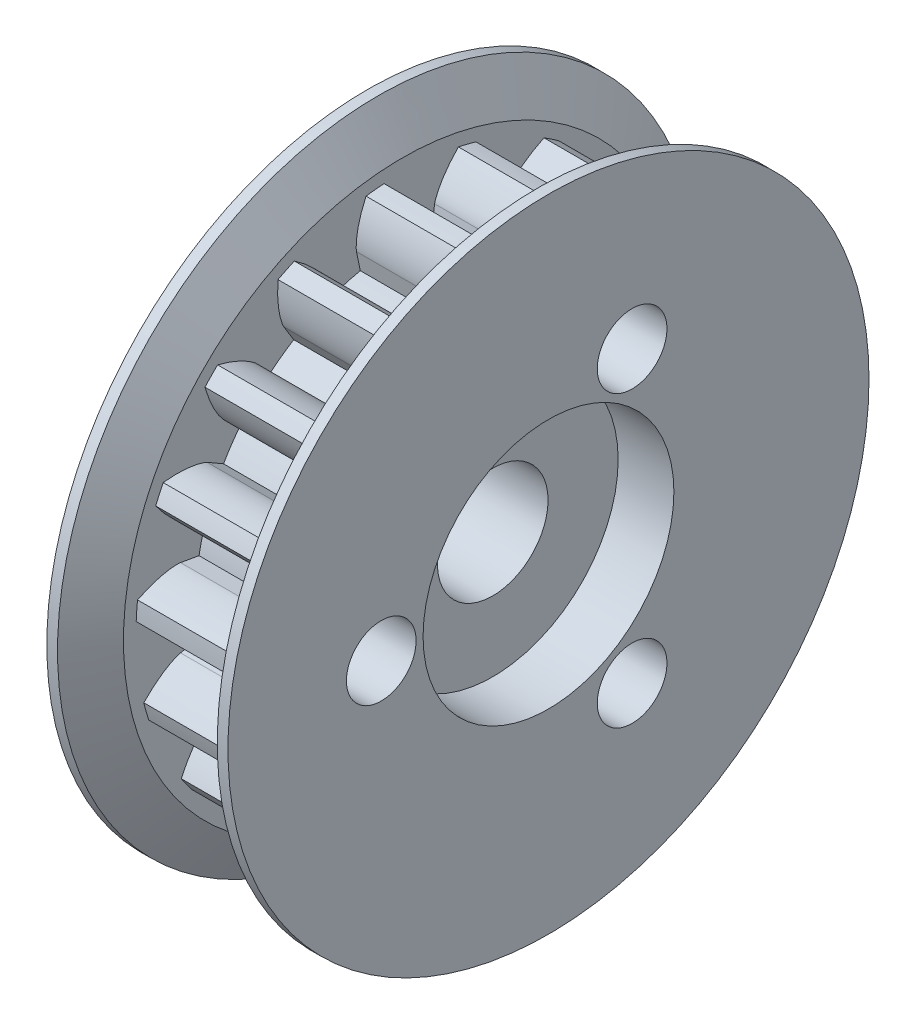
from build123d import *

# Parameters (mm, degrees)
SKETCH1_R                 = 9.549296586
BOSS_EXTRUDE1_DEPTH       = 4
CUT_EXTRUDE1_DEPTH        = 15.084677155
CIRPATTERN6_COUNT         = 18
CIRPATTERN6_COPY_1_DEPTH  = 15.084677155
CIRPATTERN6_COPY_2_DEPTH  = 15.084677155
CIRPATTERN6_COPY_3_DEPTH  = 15.084677155
CIRPATTERN6_COPY_4_DEPTH  = 15.084677155
CIRPATTERN6_COPY_5_DEPTH  = 15.084677155
CIRPATTERN6_COPY_6_DEPTH  = 15.084677155
CIRPATTERN6_COPY_7_DEPTH  = 15.084677155
CIRPATTERN6_COPY_8_DEPTH  = 15.084677155
CIRPATTERN6_COPY_9_DEPTH  = 15.084677155
CIRPATTERN6_COPY_10_DEPTH = 15.084677155
CIRPATTERN6_COPY_11_DEPTH = 15.084677155
CIRPATTERN6_COPY_12_DEPTH = 15.084677155
CIRPATTERN6_COPY_13_DEPTH = 15.084677155
CIRPATTERN6_COPY_14_DEPTH = 15.084677155
CIRPATTERN6_COPY_15_DEPTH = 15.084677155
CIRPATTERN6_COPY_16_DEPTH = 15.084677155
CIRPATTERN6_COPY_17_DEPTH = 15.084677155
SKETCH6_R                 = 1.984375
CUT_EXTRUDE2_DEPTH        = 18.514279888
HOLE4_D                   = 2.5
HOLE4_CBORE_D             = 3.5
HOLE4_CBORE_DEPTH         = 1
SKETCH5_R                 = 4.5
CUT_EXTRUDE3_DEPTH        = 2


with BuildPart() as part:
    # Sketch1 → Boss-Extrude1 (new body)
    with BuildSketch(Plane.YZ):
        with Locations(Location((0, 0, 0), (0, 0, 270))):
            Circle(SKETCH1_R)
    extrude(amount=BOSS_EXTRUDE1_DEPTH)

    # Sketch3 → Cut-Extrude1 (cut, through all)
    with BuildSketch(Plane.YZ.offset(4)):
        with BuildLine():
            Line((8.571875563, -0.62136318), (8.054928213, -0.583890395))
            Line((8.054928213, -0.583890395), (7.381337291, -0.535062738))
            ThreePointArc((7.381337291, -0.535062738), (7.395861378, -0.267706573), (7.400704854, 0))
            Line((7.400704854, 0), (8.076063182, 0))
            add(Edge.make_bspline(
                [(8.076063182, 0), (8.082033841, 0.00012635), (8.09876703, 0.000871736), (8.130332052, 0.00382423), (8.181625521, 0.010826224), (8.246585108, 0.022945376), (8.32993152, 0.042257196), (8.427178635, 0.069664315), (8.532881284, 0.104618669), (8.646430098, 0.147804525), (8.758283349, 0.195402246), (8.868399918, 0.247029253), (8.976688187, 0.302165598), (9.106061191, 0.373264706), (9.258599749, 0.464478117), (9.432758228, 0.579565538), (9.625120919, 0.719945389), (9.815166147, 0.873205208), (9.997074527, 1.03228781), (10.174564543, 1.202154555), (10.341789235, 1.372967989), (10.508498401, 1.5592586), (10.658859456, 1.735776296), (10.819120577, 1.942858552), (10.946095868, 2.112747676), (11.070131984, 2.295661885), (11.12943513, 2.385763569), (11.159288398, 2.432257279)],
                knots=[0, 0, 0, 0, 0, 0.005376748, 0.015083688, 0.02853182, 0.046610139, 0.064854849, 0.092110525, 0.119476175, 0.146842495, 0.174208853, 0.201574955, 0.228941013, 0.256307345, 0.307035032, 0.361767351, 0.41649966, 0.471231936, 0.525964281, 0.580696615, 0.635428982, 0.690161387, 0.744893688, 0.799626083, 0.854358408, 0.909090916, 0.909090916, 0.909090916, 0.909090916, 0.909090916], degree=4))
            Line((11.159288398, 2.432257279), (11.159288398, -0.80892109))
            Line((11.159288398, -0.80892109), (8.571875563, -0.62136318))
        make_face()
    cut_extrude1 = extrude(amount=-CUT_EXTRUDE1_DEPTH, mode=Mode.SUBTRACT)

    # Mirror1: Cut-Extrude1 across plane
    add(cut_extrude1.mirror(Plane(origin=(0, 8.571875563, -0.62136318), x_dir=(1, 0, 0), z_dir=(0, -0.07229888895007913, -0.9973830110126121))), mode=Mode.SUBTRACT)

    # CirPattern6: Cut-Extrude1 ×18 about axis
    cirpattern6_axis = Axis((4, 0, 0), (-1, 0, 0))
    for i in range(1, CIRPATTERN6_COUNT):
        add(cut_extrude1.rotate(cirpattern6_axis, i * 360 / CIRPATTERN6_COUNT), mode=Mode.SUBTRACT)

    # CirPattern6 copy 1 sketch → CirPattern6 copy 1 (cut, through all)
    with BuildSketch(Plane(origin=(4, 0, 0), x_dir=(0, 0.8805429024335611, -0.4739664513168418), z_dir=(1, 0, 0))):
        with BuildLine():
            Line((8.571875563, 0.62136318), (8.054928213, 0.583890395))
            Line((8.054928213, 0.583890395), (7.381337291, 0.535062738))
            ThreePointArc((7.381337291, 0.535062738), (7.395861378, 0.267706573), (7.400704854, 0))
            Line((7.400704854, 0), (8.076063182, 0))
            add(Edge.make_bspline(
                [(8.076063182, 0), (8.082033841, -0.00012635), (8.09876703, -0.000871736), (8.130332052, -0.00382423), (8.181625521, -0.010826224), (8.246585108, -0.022945376), (8.32993152, -0.042257196), (8.427178635, -0.069664315), (8.532881284, -0.104618669), (8.646430098, -0.147804525), (8.758283349, -0.195402246), (8.868399918, -0.247029253), (8.976688187, -0.302165598), (9.106061191, -0.373264706), (9.258599749, -0.464478117), (9.432758228, -0.579565538), (9.625120919, -0.719945389), (9.815166147, -0.873205208), (9.997074527, -1.03228781), (10.174564543, -1.202154555), (10.341789235, -1.372967989), (10.508498401, -1.5592586), (10.658859456, -1.735776296), (10.819120577, -1.942858552), (10.946095868, -2.112747676), (11.070131984, -2.295661885), (11.12943513, -2.385763569), (11.159288398, -2.432257279)],
                knots=[0, 0, 0, 0, 0, 0.005376748, 0.015083688, 0.02853182, 0.046610139, 0.064854849, 0.092110525, 0.119476175, 0.146842495, 0.174208853, 0.201574955, 0.228941013, 0.256307345, 0.307035032, 0.361767351, 0.41649966, 0.471231936, 0.525964281, 0.580696615, 0.635428982, 0.690161387, 0.744893688, 0.799626083, 0.854358408, 0.909090916, 0.909090916, 0.909090916, 0.909090916, 0.909090916], degree=4))
            Line((11.159288398, -2.432257279), (11.159288398, 0.80892109))
            Line((11.159288398, 0.80892109), (8.571875563, 0.62136318))
        make_face()
    extrude(amount=-CIRPATTERN6_COPY_1_DEPTH, mode=Mode.SUBTRACT)

    # CirPattern6 copy 2 sketch → CirPattern6 copy 2 (cut, through all)
    with BuildSketch(Plane(origin=(4, 0, 0), x_dir=(0, 0.6653335940912787, -0.7465461864972466), z_dir=(1, 0, 0))):
        with BuildLine():
            Line((8.571875563, 0.62136318), (8.054928213, 0.583890395))
            Line((8.054928213, 0.583890395), (7.381337291, 0.535062738))
            ThreePointArc((7.381337291, 0.535062738), (7.395861378, 0.267706573), (7.400704854, 0))
            Line((7.400704854, 0), (8.076063182, 0))
            add(Edge.make_bspline(
                [(8.076063182, 0), (8.082033841, -0.00012635), (8.09876703, -0.000871736), (8.130332052, -0.00382423), (8.181625521, -0.010826224), (8.246585108, -0.022945376), (8.32993152, -0.042257196), (8.427178635, -0.069664315), (8.532881284, -0.104618669), (8.646430098, -0.147804525), (8.758283349, -0.195402246), (8.868399918, -0.247029253), (8.976688187, -0.302165598), (9.106061191, -0.373264706), (9.258599749, -0.464478117), (9.432758228, -0.579565538), (9.625120919, -0.719945389), (9.815166147, -0.873205208), (9.997074527, -1.03228781), (10.174564543, -1.202154555), (10.341789235, -1.372967989), (10.508498401, -1.5592586), (10.658859456, -1.735776296), (10.819120577, -1.942858552), (10.946095868, -2.112747676), (11.070131984, -2.295661885), (11.12943513, -2.385763569), (11.159288398, -2.432257279)],
                knots=[0, 0, 0, 0, 0, 0.005376748, 0.015083688, 0.02853182, 0.046610139, 0.064854849, 0.092110525, 0.119476175, 0.146842495, 0.174208853, 0.201574955, 0.228941013, 0.256307345, 0.307035032, 0.361767351, 0.41649966, 0.471231936, 0.525964281, 0.580696615, 0.635428982, 0.690161387, 0.744893688, 0.799626083, 0.854358408, 0.909090916, 0.909090916, 0.909090916, 0.909090916, 0.909090916], degree=4))
            Line((11.159288398, -2.432257279), (11.159288398, 0.80892109))
            Line((11.159288398, 0.80892109), (8.571875563, 0.62136318))
        make_face()
    extrude(amount=-CIRPATTERN6_COPY_2_DEPTH, mode=Mode.SUBTRACT)

    # CirPattern6 copy 3 sketch → CirPattern6 copy 3 (cut, through all)
    with BuildSketch(Plane(origin=(4, 0, 0), x_dir=(0, 0.3698752350235218, -0.9290814337378046), z_dir=(1, 0, 0))):
        with BuildLine():
            Line((8.571875563, 0.62136318), (8.054928213, 0.583890395))
            Line((8.054928213, 0.583890395), (7.381337291, 0.535062738))
            ThreePointArc((7.381337291, 0.535062738), (7.395861378, 0.267706573), (7.400704854, 0))
            Line((7.400704854, 0), (8.076063182, 0))
            add(Edge.make_bspline(
                [(8.076063182, 0), (8.082033841, -0.00012635), (8.09876703, -0.000871736), (8.130332052, -0.00382423), (8.181625521, -0.010826224), (8.246585108, -0.022945376), (8.32993152, -0.042257196), (8.427178635, -0.069664315), (8.532881284, -0.104618669), (8.646430098, -0.147804525), (8.758283349, -0.195402246), (8.868399918, -0.247029253), (8.976688187, -0.302165598), (9.106061191, -0.373264706), (9.258599749, -0.464478117), (9.432758228, -0.579565538), (9.625120919, -0.719945389), (9.815166147, -0.873205208), (9.997074527, -1.03228781), (10.174564543, -1.202154555), (10.341789235, -1.372967989), (10.508498401, -1.5592586), (10.658859456, -1.735776296), (10.819120577, -1.942858552), (10.946095868, -2.112747676), (11.070131984, -2.295661885), (11.12943513, -2.385763569), (11.159288398, -2.432257279)],
                knots=[0, 0, 0, 0, 0, 0.005376748, 0.015083688, 0.02853182, 0.046610139, 0.064854849, 0.092110525, 0.119476175, 0.146842495, 0.174208853, 0.201574955, 0.228941013, 0.256307345, 0.307035032, 0.361767351, 0.41649966, 0.471231936, 0.525964281, 0.580696615, 0.635428982, 0.690161387, 0.744893688, 0.799626083, 0.854358408, 0.909090916, 0.909090916, 0.909090916, 0.909090916, 0.909090916], degree=4))
            Line((11.159288398, -2.432257279), (11.159288398, 0.80892109))
            Line((11.159288398, 0.80892109), (8.571875563, 0.62136318))
        make_face()
    extrude(amount=-CIRPATTERN6_COPY_3_DEPTH, mode=Mode.SUBTRACT)

    # CirPattern6 copy 4 sketch → CirPattern6 copy 4 (cut, through all)
    with BuildSketch(Plane(origin=(4, 0, 0), x_dir=(0, 0.029804463834835232, -0.9995557482879672), z_dir=(1, 0, 0))):
        with BuildLine():
            Line((8.571875563, 0.62136318), (8.054928213, 0.583890395))
            Line((8.054928213, 0.583890395), (7.381337291, 0.535062738))
            ThreePointArc((7.381337291, 0.535062738), (7.395861378, 0.267706573), (7.400704854, 0))
            Line((7.400704854, 0), (8.076063182, 0))
            add(Edge.make_bspline(
                [(8.076063182, 0), (8.082033841, -0.00012635), (8.09876703, -0.000871736), (8.130332052, -0.00382423), (8.181625521, -0.010826224), (8.246585108, -0.022945376), (8.32993152, -0.042257196), (8.427178635, -0.069664315), (8.532881284, -0.104618669), (8.646430098, -0.147804525), (8.758283349, -0.195402246), (8.868399918, -0.247029253), (8.976688187, -0.302165598), (9.106061191, -0.373264706), (9.258599749, -0.464478117), (9.432758228, -0.579565538), (9.625120919, -0.719945389), (9.815166147, -0.873205208), (9.997074527, -1.03228781), (10.174564543, -1.202154555), (10.341789235, -1.372967989), (10.508498401, -1.5592586), (10.658859456, -1.735776296), (10.819120577, -1.942858552), (10.946095868, -2.112747676), (11.070131984, -2.295661885), (11.12943513, -2.385763569), (11.159288398, -2.432257279)],
                knots=[0, 0, 0, 0, 0, 0.005376748, 0.015083688, 0.02853182, 0.046610139, 0.064854849, 0.092110525, 0.119476175, 0.146842495, 0.174208853, 0.201574955, 0.228941013, 0.256307345, 0.307035032, 0.361767351, 0.41649966, 0.471231936, 0.525964281, 0.580696615, 0.635428982, 0.690161387, 0.744893688, 0.799626083, 0.854358408, 0.909090916, 0.909090916, 0.909090916, 0.909090916, 0.909090916], degree=4))
            Line((11.159288398, -2.432257279), (11.159288398, 0.80892109))
            Line((11.159288398, 0.80892109), (8.571875563, 0.62136318))
        make_face()
    extrude(amount=-CIRPATTERN6_COPY_4_DEPTH, mode=Mode.SUBTRACT)

    # CirPattern6 copy 5 sketch → CirPattern6 copy 5 (cut, through all)
    with BuildSketch(Plane(origin=(4, 0, 0), x_dir=(0, -0.3138611655593715, -0.9494688877228746), z_dir=(1, 0, 0))):
        with BuildLine():
            Line((8.571875563, 0.62136318), (8.054928213, 0.583890395))
            Line((8.054928213, 0.583890395), (7.381337291, 0.535062738))
            ThreePointArc((7.381337291, 0.535062738), (7.395861378, 0.267706573), (7.400704854, 0))
            Line((7.400704854, 0), (8.076063182, 0))
            add(Edge.make_bspline(
                [(8.076063182, 0), (8.082033841, -0.00012635), (8.09876703, -0.000871736), (8.130332052, -0.00382423), (8.181625521, -0.010826224), (8.246585108, -0.022945376), (8.32993152, -0.042257196), (8.427178635, -0.069664315), (8.532881284, -0.104618669), (8.646430098, -0.147804525), (8.758283349, -0.195402246), (8.868399918, -0.247029253), (8.976688187, -0.302165598), (9.106061191, -0.373264706), (9.258599749, -0.464478117), (9.432758228, -0.579565538), (9.625120919, -0.719945389), (9.815166147, -0.873205208), (9.997074527, -1.03228781), (10.174564543, -1.202154555), (10.341789235, -1.372967989), (10.508498401, -1.5592586), (10.658859456, -1.735776296), (10.819120577, -1.942858552), (10.946095868, -2.112747676), (11.070131984, -2.295661885), (11.12943513, -2.385763569), (11.159288398, -2.432257279)],
                knots=[0, 0, 0, 0, 0, 0.005376748, 0.015083688, 0.02853182, 0.046610139, 0.064854849, 0.092110525, 0.119476175, 0.146842495, 0.174208853, 0.201574955, 0.228941013, 0.256307345, 0.307035032, 0.361767351, 0.41649966, 0.471231936, 0.525964281, 0.580696615, 0.635428982, 0.690161387, 0.744893688, 0.799626083, 0.854358408, 0.909090916, 0.909090916, 0.909090916, 0.909090916, 0.909090916], degree=4))
            Line((11.159288398, -2.432257279), (11.159288398, 0.80892109))
            Line((11.159288398, 0.80892109), (8.571875563, 0.62136318))
        make_face()
    extrude(amount=-CIRPATTERN6_COPY_5_DEPTH, mode=Mode.SUBTRACT)

    # CirPattern6 copy 6 sketch → CirPattern6 copy 6 (cut, through all)
    with BuildSketch(Plane(origin=(4, 0, 0), x_dir=(0, -0.6196705062896464, -0.784862066630012), z_dir=(1, 0, 0))):
        with BuildLine():
            Line((8.571875563, 0.62136318), (8.054928213, 0.583890395))
            Line((8.054928213, 0.583890395), (7.381337291, 0.535062738))
            ThreePointArc((7.381337291, 0.535062738), (7.395861378, 0.267706573), (7.400704854, 0))
            Line((7.400704854, 0), (8.076063182, 0))
            add(Edge.make_bspline(
                [(8.076063182, 0), (8.082033841, -0.00012635), (8.09876703, -0.000871736), (8.130332052, -0.00382423), (8.181625521, -0.010826224), (8.246585108, -0.022945376), (8.32993152, -0.042257196), (8.427178635, -0.069664315), (8.532881284, -0.104618669), (8.646430098, -0.147804525), (8.758283349, -0.195402246), (8.868399918, -0.247029253), (8.976688187, -0.302165598), (9.106061191, -0.373264706), (9.258599749, -0.464478117), (9.432758228, -0.579565538), (9.625120919, -0.719945389), (9.815166147, -0.873205208), (9.997074527, -1.03228781), (10.174564543, -1.202154555), (10.341789235, -1.372967989), (10.508498401, -1.5592586), (10.658859456, -1.735776296), (10.819120577, -1.942858552), (10.946095868, -2.112747676), (11.070131984, -2.295661885), (11.12943513, -2.385763569), (11.159288398, -2.432257279)],
                knots=[0, 0, 0, 0, 0, 0.005376748, 0.015083688, 0.02853182, 0.046610139, 0.064854849, 0.092110525, 0.119476175, 0.146842495, 0.174208853, 0.201574955, 0.228941013, 0.256307345, 0.307035032, 0.361767351, 0.41649966, 0.471231936, 0.525964281, 0.580696615, 0.635428982, 0.690161387, 0.744893688, 0.799626083, 0.854358408, 0.909090916, 0.909090916, 0.909090916, 0.909090916, 0.909090916], degree=4))
            Line((11.159288398, -2.432257279), (11.159288398, 0.80892109))
            Line((11.159288398, 0.80892109), (8.571875563, 0.62136318))
        make_face()
    extrude(amount=-CIRPATTERN6_COPY_6_DEPTH, mode=Mode.SUBTRACT)

    # CirPattern6 copy 7 sketch → CirPattern6 copy 7 (cut, through all)
    with BuildSketch(Plane(origin=(4, 0, 0), x_dir=(0, -0.8507384385987258, -0.5255892969711257), z_dir=(1, 0, 0))):
        with BuildLine():
            Line((8.571875563, 0.62136318), (8.054928213, 0.583890395))
            Line((8.054928213, 0.583890395), (7.381337291, 0.535062738))
            ThreePointArc((7.381337291, 0.535062738), (7.395861378, 0.267706573), (7.400704854, 0))
            Line((7.400704854, 0), (8.076063182, 0))
            add(Edge.make_bspline(
                [(8.076063182, 0), (8.082033841, -0.00012635), (8.09876703, -0.000871736), (8.130332052, -0.00382423), (8.181625521, -0.010826224), (8.246585108, -0.022945376), (8.32993152, -0.042257196), (8.427178635, -0.069664315), (8.532881284, -0.104618669), (8.646430098, -0.147804525), (8.758283349, -0.195402246), (8.868399918, -0.247029253), (8.976688187, -0.302165598), (9.106061191, -0.373264706), (9.258599749, -0.464478117), (9.432758228, -0.579565538), (9.625120919, -0.719945389), (9.815166147, -0.873205208), (9.997074527, -1.03228781), (10.174564543, -1.202154555), (10.341789235, -1.372967989), (10.508498401, -1.5592586), (10.658859456, -1.735776296), (10.819120577, -1.942858552), (10.946095868, -2.112747676), (11.070131984, -2.295661885), (11.12943513, -2.385763569), (11.159288398, -2.432257279)],
                knots=[0, 0, 0, 0, 0, 0.005376748, 0.015083688, 0.02853182, 0.046610139, 0.064854849, 0.092110525, 0.119476175, 0.146842495, 0.174208853, 0.201574955, 0.228941013, 0.256307345, 0.307035032, 0.361767351, 0.41649966, 0.471231936, 0.525964281, 0.580696615, 0.635428982, 0.690161387, 0.744893688, 0.799626083, 0.854358408, 0.909090916, 0.909090916, 0.909090916, 0.909090916, 0.909090916], degree=4))
            Line((11.159288398, -2.432257279), (11.159288398, 0.80892109))
            Line((11.159288398, 0.80892109), (8.571875563, 0.62136318))
        make_face()
    extrude(amount=-CIRPATTERN6_COPY_7_DEPTH, mode=Mode.SUBTRACT)

    # CirPattern6 copy 8 sketch → CirPattern6 copy 8 (cut, through all)
    with BuildSketch(Plane(origin=(4, 0, 0), x_dir=(0, -0.9791947596506502, -0.20292270122562825), z_dir=(1, 0, 0))):
        with BuildLine():
            Line((8.571875563, 0.62136318), (8.054928213, 0.583890395))
            Line((8.054928213, 0.583890395), (7.381337291, 0.535062738))
            ThreePointArc((7.381337291, 0.535062738), (7.395861378, 0.267706573), (7.400704854, 0))
            Line((7.400704854, 0), (8.076063182, 0))
            add(Edge.make_bspline(
                [(8.076063182, 0), (8.082033841, -0.00012635), (8.09876703, -0.000871736), (8.130332052, -0.00382423), (8.181625521, -0.010826224), (8.246585108, -0.022945376), (8.32993152, -0.042257196), (8.427178635, -0.069664315), (8.532881284, -0.104618669), (8.646430098, -0.147804525), (8.758283349, -0.195402246), (8.868399918, -0.247029253), (8.976688187, -0.302165598), (9.106061191, -0.373264706), (9.258599749, -0.464478117), (9.432758228, -0.579565538), (9.625120919, -0.719945389), (9.815166147, -0.873205208), (9.997074527, -1.03228781), (10.174564543, -1.202154555), (10.341789235, -1.372967989), (10.508498401, -1.5592586), (10.658859456, -1.735776296), (10.819120577, -1.942858552), (10.946095868, -2.112747676), (11.070131984, -2.295661885), (11.12943513, -2.385763569), (11.159288398, -2.432257279)],
                knots=[0, 0, 0, 0, 0, 0.005376748, 0.015083688, 0.02853182, 0.046610139, 0.064854849, 0.092110525, 0.119476175, 0.146842495, 0.174208853, 0.201574955, 0.228941013, 0.256307345, 0.307035032, 0.361767351, 0.41649966, 0.471231936, 0.525964281, 0.580696615, 0.635428982, 0.690161387, 0.744893688, 0.799626083, 0.854358408, 0.909090916, 0.909090916, 0.909090916, 0.909090916, 0.909090916], degree=4))
            Line((11.159288398, -2.432257279), (11.159288398, 0.80892109))
            Line((11.159288398, 0.80892109), (8.571875563, 0.62136318))
        make_face()
    extrude(amount=-CIRPATTERN6_COPY_8_DEPTH, mode=Mode.SUBTRACT)

    # CirPattern6 copy 9 sketch → CirPattern6 copy 9 (cut, through all)
    with BuildSketch(Plane(origin=(4, 0, 0), x_dir=(0, -0.9895457413131683, 0.14421936710779268), z_dir=(1, 0, 0))):
        with BuildLine():
            Line((8.571875563, 0.62136318), (8.054928213, 0.583890395))
            Line((8.054928213, 0.583890395), (7.381337291, 0.535062738))
            ThreePointArc((7.381337291, 0.535062738), (7.395861378, 0.267706573), (7.400704854, 0))
            Line((7.400704854, 0), (8.076063182, 0))
            add(Edge.make_bspline(
                [(8.076063182, 0), (8.082033841, -0.00012635), (8.09876703, -0.000871736), (8.130332052, -0.00382423), (8.181625521, -0.010826224), (8.246585108, -0.022945376), (8.32993152, -0.042257196), (8.427178635, -0.069664315), (8.532881284, -0.104618669), (8.646430098, -0.147804525), (8.758283349, -0.195402246), (8.868399918, -0.247029253), (8.976688187, -0.302165598), (9.106061191, -0.373264706), (9.258599749, -0.464478117), (9.432758228, -0.579565538), (9.625120919, -0.719945389), (9.815166147, -0.873205208), (9.997074527, -1.03228781), (10.174564543, -1.202154555), (10.341789235, -1.372967989), (10.508498401, -1.5592586), (10.658859456, -1.735776296), (10.819120577, -1.942858552), (10.946095868, -2.112747676), (11.070131984, -2.295661885), (11.12943513, -2.385763569), (11.159288398, -2.432257279)],
                knots=[0, 0, 0, 0, 0, 0.005376748, 0.015083688, 0.02853182, 0.046610139, 0.064854849, 0.092110525, 0.119476175, 0.146842495, 0.174208853, 0.201574955, 0.228941013, 0.256307345, 0.307035032, 0.361767351, 0.41649966, 0.471231936, 0.525964281, 0.580696615, 0.635428982, 0.690161387, 0.744893688, 0.799626083, 0.854358408, 0.909090916, 0.909090916, 0.909090916, 0.909090916, 0.909090916], degree=4))
            Line((11.159288398, -2.432257279), (11.159288398, 0.80892109))
            Line((11.159288398, 0.80892109), (8.571875563, 0.62136318))
        make_face()
    extrude(amount=-CIRPATTERN6_COPY_9_DEPTH, mode=Mode.SUBTRACT)

    # CirPattern6 copy 10 sketch → CirPattern6 copy 10 (cut, through all)
    with BuildSketch(Plane(origin=(4, 0, 0), x_dir=(0, -0.8805429024335611, 0.4739664513168417), z_dir=(1, 0, 0))):
        with BuildLine():
            Line((8.571875563, 0.62136318), (8.054928213, 0.583890395))
            Line((8.054928213, 0.583890395), (7.381337291, 0.535062738))
            ThreePointArc((7.381337291, 0.535062738), (7.395861378, 0.267706573), (7.400704854, 0))
            Line((7.400704854, 0), (8.076063182, 0))
            add(Edge.make_bspline(
                [(8.076063182, 0), (8.082033841, -0.00012635), (8.09876703, -0.000871736), (8.130332052, -0.00382423), (8.181625521, -0.010826224), (8.246585108, -0.022945376), (8.32993152, -0.042257196), (8.427178635, -0.069664315), (8.532881284, -0.104618669), (8.646430098, -0.147804525), (8.758283349, -0.195402246), (8.868399918, -0.247029253), (8.976688187, -0.302165598), (9.106061191, -0.373264706), (9.258599749, -0.464478117), (9.432758228, -0.579565538), (9.625120919, -0.719945389), (9.815166147, -0.873205208), (9.997074527, -1.03228781), (10.174564543, -1.202154555), (10.341789235, -1.372967989), (10.508498401, -1.5592586), (10.658859456, -1.735776296), (10.819120577, -1.942858552), (10.946095868, -2.112747676), (11.070131984, -2.295661885), (11.12943513, -2.385763569), (11.159288398, -2.432257279)],
                knots=[0, 0, 0, 0, 0, 0.005376748, 0.015083688, 0.02853182, 0.046610139, 0.064854849, 0.092110525, 0.119476175, 0.146842495, 0.174208853, 0.201574955, 0.228941013, 0.256307345, 0.307035032, 0.361767351, 0.41649966, 0.471231936, 0.525964281, 0.580696615, 0.635428982, 0.690161387, 0.744893688, 0.799626083, 0.854358408, 0.909090916, 0.909090916, 0.909090916, 0.909090916, 0.909090916], degree=4))
            Line((11.159288398, -2.432257279), (11.159288398, 0.80892109))
            Line((11.159288398, 0.80892109), (8.571875563, 0.62136318))
        make_face()
    extrude(amount=-CIRPATTERN6_COPY_10_DEPTH, mode=Mode.SUBTRACT)

    # CirPattern6 copy 11 sketch → CirPattern6 copy 11 (cut, through all)
    with BuildSketch(Plane(origin=(4, 0, 0), x_dir=(0, -0.6653335940912787, 0.7465461864972466), z_dir=(1, 0, 0))):
        with BuildLine():
            Line((8.571875563, 0.62136318), (8.054928213, 0.583890395))
            Line((8.054928213, 0.583890395), (7.381337291, 0.535062738))
            ThreePointArc((7.381337291, 0.535062738), (7.395861378, 0.267706573), (7.400704854, 0))
            Line((7.400704854, 0), (8.076063182, 0))
            add(Edge.make_bspline(
                [(8.076063182, 0), (8.082033841, -0.00012635), (8.09876703, -0.000871736), (8.130332052, -0.00382423), (8.181625521, -0.010826224), (8.246585108, -0.022945376), (8.32993152, -0.042257196), (8.427178635, -0.069664315), (8.532881284, -0.104618669), (8.646430098, -0.147804525), (8.758283349, -0.195402246), (8.868399918, -0.247029253), (8.976688187, -0.302165598), (9.106061191, -0.373264706), (9.258599749, -0.464478117), (9.432758228, -0.579565538), (9.625120919, -0.719945389), (9.815166147, -0.873205208), (9.997074527, -1.03228781), (10.174564543, -1.202154555), (10.341789235, -1.372967989), (10.508498401, -1.5592586), (10.658859456, -1.735776296), (10.819120577, -1.942858552), (10.946095868, -2.112747676), (11.070131984, -2.295661885), (11.12943513, -2.385763569), (11.159288398, -2.432257279)],
                knots=[0, 0, 0, 0, 0, 0.005376748, 0.015083688, 0.02853182, 0.046610139, 0.064854849, 0.092110525, 0.119476175, 0.146842495, 0.174208853, 0.201574955, 0.228941013, 0.256307345, 0.307035032, 0.361767351, 0.41649966, 0.471231936, 0.525964281, 0.580696615, 0.635428982, 0.690161387, 0.744893688, 0.799626083, 0.854358408, 0.909090916, 0.909090916, 0.909090916, 0.909090916, 0.909090916], degree=4))
            Line((11.159288398, -2.432257279), (11.159288398, 0.80892109))
            Line((11.159288398, 0.80892109), (8.571875563, 0.62136318))
        make_face()
    extrude(amount=-CIRPATTERN6_COPY_11_DEPTH, mode=Mode.SUBTRACT)

    # CirPattern6 copy 12 sketch → CirPattern6 copy 12 (cut, through all)
    with BuildSketch(Plane(origin=(4, 0, 0), x_dir=(0, -0.3698752350235222, 0.9290814337378045), z_dir=(1, 0, 0))):
        with BuildLine():
            Line((8.571875563, 0.62136318), (8.054928213, 0.583890395))
            Line((8.054928213, 0.583890395), (7.381337291, 0.535062738))
            ThreePointArc((7.381337291, 0.535062738), (7.395861378, 0.267706573), (7.400704854, 0))
            Line((7.400704854, 0), (8.076063182, 0))
            add(Edge.make_bspline(
                [(8.076063182, 0), (8.082033841, -0.00012635), (8.09876703, -0.000871736), (8.130332052, -0.00382423), (8.181625521, -0.010826224), (8.246585108, -0.022945376), (8.32993152, -0.042257196), (8.427178635, -0.069664315), (8.532881284, -0.104618669), (8.646430098, -0.147804525), (8.758283349, -0.195402246), (8.868399918, -0.247029253), (8.976688187, -0.302165598), (9.106061191, -0.373264706), (9.258599749, -0.464478117), (9.432758228, -0.579565538), (9.625120919, -0.719945389), (9.815166147, -0.873205208), (9.997074527, -1.03228781), (10.174564543, -1.202154555), (10.341789235, -1.372967989), (10.508498401, -1.5592586), (10.658859456, -1.735776296), (10.819120577, -1.942858552), (10.946095868, -2.112747676), (11.070131984, -2.295661885), (11.12943513, -2.385763569), (11.159288398, -2.432257279)],
                knots=[0, 0, 0, 0, 0, 0.005376748, 0.015083688, 0.02853182, 0.046610139, 0.064854849, 0.092110525, 0.119476175, 0.146842495, 0.174208853, 0.201574955, 0.228941013, 0.256307345, 0.307035032, 0.361767351, 0.41649966, 0.471231936, 0.525964281, 0.580696615, 0.635428982, 0.690161387, 0.744893688, 0.799626083, 0.854358408, 0.909090916, 0.909090916, 0.909090916, 0.909090916, 0.909090916], degree=4))
            Line((11.159288398, -2.432257279), (11.159288398, 0.80892109))
            Line((11.159288398, 0.80892109), (8.571875563, 0.62136318))
        make_face()
    extrude(amount=-CIRPATTERN6_COPY_12_DEPTH, mode=Mode.SUBTRACT)

    # CirPattern6 copy 13 sketch → CirPattern6 copy 13 (cut, through all)
    with BuildSketch(Plane(origin=(4, 0, 0), x_dir=(0, -0.02980446383483515, 0.9995557482879672), z_dir=(1, 0, 0))):
        with BuildLine():
            Line((8.571875563, 0.62136318), (8.054928213, 0.583890395))
            Line((8.054928213, 0.583890395), (7.381337291, 0.535062738))
            ThreePointArc((7.381337291, 0.535062738), (7.395861378, 0.267706573), (7.400704854, 0))
            Line((7.400704854, 0), (8.076063182, 0))
            add(Edge.make_bspline(
                [(8.076063182, 0), (8.082033841, -0.00012635), (8.09876703, -0.000871736), (8.130332052, -0.00382423), (8.181625521, -0.010826224), (8.246585108, -0.022945376), (8.32993152, -0.042257196), (8.427178635, -0.069664315), (8.532881284, -0.104618669), (8.646430098, -0.147804525), (8.758283349, -0.195402246), (8.868399918, -0.247029253), (8.976688187, -0.302165598), (9.106061191, -0.373264706), (9.258599749, -0.464478117), (9.432758228, -0.579565538), (9.625120919, -0.719945389), (9.815166147, -0.873205208), (9.997074527, -1.03228781), (10.174564543, -1.202154555), (10.341789235, -1.372967989), (10.508498401, -1.5592586), (10.658859456, -1.735776296), (10.819120577, -1.942858552), (10.946095868, -2.112747676), (11.070131984, -2.295661885), (11.12943513, -2.385763569), (11.159288398, -2.432257279)],
                knots=[0, 0, 0, 0, 0, 0.005376748, 0.015083688, 0.02853182, 0.046610139, 0.064854849, 0.092110525, 0.119476175, 0.146842495, 0.174208853, 0.201574955, 0.228941013, 0.256307345, 0.307035032, 0.361767351, 0.41649966, 0.471231936, 0.525964281, 0.580696615, 0.635428982, 0.690161387, 0.744893688, 0.799626083, 0.854358408, 0.909090916, 0.909090916, 0.909090916, 0.909090916, 0.909090916], degree=4))
            Line((11.159288398, -2.432257279), (11.159288398, 0.80892109))
            Line((11.159288398, 0.80892109), (8.571875563, 0.62136318))
        make_face()
    extrude(amount=-CIRPATTERN6_COPY_13_DEPTH, mode=Mode.SUBTRACT)

    # CirPattern6 copy 14 sketch → CirPattern6 copy 14 (cut, through all)
    with BuildSketch(Plane(origin=(4, 0, 0), x_dir=(0, 0.31386116555937116, 0.9494688877228749), z_dir=(1, 0, 0))):
        with BuildLine():
            Line((8.571875563, 0.62136318), (8.054928213, 0.583890395))
            Line((8.054928213, 0.583890395), (7.381337291, 0.535062738))
            ThreePointArc((7.381337291, 0.535062738), (7.395861378, 0.267706573), (7.400704854, 0))
            Line((7.400704854, 0), (8.076063182, 0))
            add(Edge.make_bspline(
                [(8.076063182, 0), (8.082033841, -0.00012635), (8.09876703, -0.000871736), (8.130332052, -0.00382423), (8.181625521, -0.010826224), (8.246585108, -0.022945376), (8.32993152, -0.042257196), (8.427178635, -0.069664315), (8.532881284, -0.104618669), (8.646430098, -0.147804525), (8.758283349, -0.195402246), (8.868399918, -0.247029253), (8.976688187, -0.302165598), (9.106061191, -0.373264706), (9.258599749, -0.464478117), (9.432758228, -0.579565538), (9.625120919, -0.719945389), (9.815166147, -0.873205208), (9.997074527, -1.03228781), (10.174564543, -1.202154555), (10.341789235, -1.372967989), (10.508498401, -1.5592586), (10.658859456, -1.735776296), (10.819120577, -1.942858552), (10.946095868, -2.112747676), (11.070131984, -2.295661885), (11.12943513, -2.385763569), (11.159288398, -2.432257279)],
                knots=[0, 0, 0, 0, 0, 0.005376748, 0.015083688, 0.02853182, 0.046610139, 0.064854849, 0.092110525, 0.119476175, 0.146842495, 0.174208853, 0.201574955, 0.228941013, 0.256307345, 0.307035032, 0.361767351, 0.41649966, 0.471231936, 0.525964281, 0.580696615, 0.635428982, 0.690161387, 0.744893688, 0.799626083, 0.854358408, 0.909090916, 0.909090916, 0.909090916, 0.909090916, 0.909090916], degree=4))
            Line((11.159288398, -2.432257279), (11.159288398, 0.80892109))
            Line((11.159288398, 0.80892109), (8.571875563, 0.62136318))
        make_face()
    extrude(amount=-CIRPATTERN6_COPY_14_DEPTH, mode=Mode.SUBTRACT)

    # CirPattern6 copy 15 sketch → CirPattern6 copy 15 (cut, through all)
    with BuildSketch(Plane(origin=(4, 0, 0), x_dir=(0, 0.6196705062896467, 0.7848620666300119), z_dir=(1, 0, 0))):
        with BuildLine():
            Line((8.571875563, 0.62136318), (8.054928213, 0.583890395))
            Line((8.054928213, 0.583890395), (7.381337291, 0.535062738))
            ThreePointArc((7.381337291, 0.535062738), (7.395861378, 0.267706573), (7.400704854, 0))
            Line((7.400704854, 0), (8.076063182, 0))
            add(Edge.make_bspline(
                [(8.076063182, 0), (8.082033841, -0.00012635), (8.09876703, -0.000871736), (8.130332052, -0.00382423), (8.181625521, -0.010826224), (8.246585108, -0.022945376), (8.32993152, -0.042257196), (8.427178635, -0.069664315), (8.532881284, -0.104618669), (8.646430098, -0.147804525), (8.758283349, -0.195402246), (8.868399918, -0.247029253), (8.976688187, -0.302165598), (9.106061191, -0.373264706), (9.258599749, -0.464478117), (9.432758228, -0.579565538), (9.625120919, -0.719945389), (9.815166147, -0.873205208), (9.997074527, -1.03228781), (10.174564543, -1.202154555), (10.341789235, -1.372967989), (10.508498401, -1.5592586), (10.658859456, -1.735776296), (10.819120577, -1.942858552), (10.946095868, -2.112747676), (11.070131984, -2.295661885), (11.12943513, -2.385763569), (11.159288398, -2.432257279)],
                knots=[0, 0, 0, 0, 0, 0.005376748, 0.015083688, 0.02853182, 0.046610139, 0.064854849, 0.092110525, 0.119476175, 0.146842495, 0.174208853, 0.201574955, 0.228941013, 0.256307345, 0.307035032, 0.361767351, 0.41649966, 0.471231936, 0.525964281, 0.580696615, 0.635428982, 0.690161387, 0.744893688, 0.799626083, 0.854358408, 0.909090916, 0.909090916, 0.909090916, 0.909090916, 0.909090916], degree=4))
            Line((11.159288398, -2.432257279), (11.159288398, 0.80892109))
            Line((11.159288398, 0.80892109), (8.571875563, 0.62136318))
        make_face()
    extrude(amount=-CIRPATTERN6_COPY_15_DEPTH, mode=Mode.SUBTRACT)

    # CirPattern6 copy 16 sketch → CirPattern6 copy 16 (cut, through all)
    with BuildSketch(Plane(origin=(4, 0, 0), x_dir=(0, 0.8507384385987258, 0.5255892969711258), z_dir=(1, 0, 0))):
        with BuildLine():
            Line((8.571875563, 0.62136318), (8.054928213, 0.583890395))
            Line((8.054928213, 0.583890395), (7.381337291, 0.535062738))
            ThreePointArc((7.381337291, 0.535062738), (7.395861378, 0.267706573), (7.400704854, 0))
            Line((7.400704854, 0), (8.076063182, 0))
            add(Edge.make_bspline(
                [(8.076063182, 0), (8.082033841, -0.00012635), (8.09876703, -0.000871736), (8.130332052, -0.00382423), (8.181625521, -0.010826224), (8.246585108, -0.022945376), (8.32993152, -0.042257196), (8.427178635, -0.069664315), (8.532881284, -0.104618669), (8.646430098, -0.147804525), (8.758283349, -0.195402246), (8.868399918, -0.247029253), (8.976688187, -0.302165598), (9.106061191, -0.373264706), (9.258599749, -0.464478117), (9.432758228, -0.579565538), (9.625120919, -0.719945389), (9.815166147, -0.873205208), (9.997074527, -1.03228781), (10.174564543, -1.202154555), (10.341789235, -1.372967989), (10.508498401, -1.5592586), (10.658859456, -1.735776296), (10.819120577, -1.942858552), (10.946095868, -2.112747676), (11.070131984, -2.295661885), (11.12943513, -2.385763569), (11.159288398, -2.432257279)],
                knots=[0, 0, 0, 0, 0, 0.005376748, 0.015083688, 0.02853182, 0.046610139, 0.064854849, 0.092110525, 0.119476175, 0.146842495, 0.174208853, 0.201574955, 0.228941013, 0.256307345, 0.307035032, 0.361767351, 0.41649966, 0.471231936, 0.525964281, 0.580696615, 0.635428982, 0.690161387, 0.744893688, 0.799626083, 0.854358408, 0.909090916, 0.909090916, 0.909090916, 0.909090916, 0.909090916], degree=4))
            Line((11.159288398, -2.432257279), (11.159288398, 0.80892109))
            Line((11.159288398, 0.80892109), (8.571875563, 0.62136318))
        make_face()
    extrude(amount=-CIRPATTERN6_COPY_16_DEPTH, mode=Mode.SUBTRACT)

    # CirPattern6 copy 17 sketch → CirPattern6 copy 17 (cut, through all)
    with BuildSketch(Plane(origin=(4, 0, 0), x_dir=(0, 0.9791947596506502, 0.20292270122562797), z_dir=(1, 0, 0))):
        with BuildLine():
            Line((8.571875563, 0.62136318), (8.054928213, 0.583890395))
            Line((8.054928213, 0.583890395), (7.381337291, 0.535062738))
            ThreePointArc((7.381337291, 0.535062738), (7.395861378, 0.267706573), (7.400704854, 0))
            Line((7.400704854, 0), (8.076063182, 0))
            add(Edge.make_bspline(
                [(8.076063182, 0), (8.082033841, -0.00012635), (8.09876703, -0.000871736), (8.130332052, -0.00382423), (8.181625521, -0.010826224), (8.246585108, -0.022945376), (8.32993152, -0.042257196), (8.427178635, -0.069664315), (8.532881284, -0.104618669), (8.646430098, -0.147804525), (8.758283349, -0.195402246), (8.868399918, -0.247029253), (8.976688187, -0.302165598), (9.106061191, -0.373264706), (9.258599749, -0.464478117), (9.432758228, -0.579565538), (9.625120919, -0.719945389), (9.815166147, -0.873205208), (9.997074527, -1.03228781), (10.174564543, -1.202154555), (10.341789235, -1.372967989), (10.508498401, -1.5592586), (10.658859456, -1.735776296), (10.819120577, -1.942858552), (10.946095868, -2.112747676), (11.070131984, -2.295661885), (11.12943513, -2.385763569), (11.159288398, -2.432257279)],
                knots=[0, 0, 0, 0, 0, 0.005376748, 0.015083688, 0.02853182, 0.046610139, 0.064854849, 0.092110525, 0.119476175, 0.146842495, 0.174208853, 0.201574955, 0.228941013, 0.256307345, 0.307035032, 0.361767351, 0.41649966, 0.471231936, 0.525964281, 0.580696615, 0.635428982, 0.690161387, 0.744893688, 0.799626083, 0.854358408, 0.909090916, 0.909090916, 0.909090916, 0.909090916, 0.909090916], degree=4))
            Line((11.159288398, -2.432257279), (11.159288398, 0.80892109))
            Line((11.159288398, 0.80892109), (8.571875563, 0.62136318))
        make_face()
    extrude(amount=-CIRPATTERN6_COPY_17_DEPTH, mode=Mode.SUBTRACT)

    # Sketch4 → Revolve1 (revolve)
    with BuildSketch(Plane(origin=(0, 0, 0), x_dir=(-1, 0, 0), z_dir=(0, 1, 0)), mode=Mode.PRIVATE) as revolve1_sk:
        Polygon((-4, 0), (-4, 10), (-4.866025404, 11.5), (-5.25, 11.5), (-5.25, 0), align=None)
        Polygon((0, 0), (1.25, 0), (1.25, 11.5), (0.866025404, 11.5), (0, 10), align=None)
    revolve(revolve1_sk.sketch.rotate(Axis((9.291003126, 0, 0), (-1, 0, 0)), 180), axis=Axis((9.291003126, 0, 0), (-1, 0, 0)))

    # Sketch6 → Cut-Extrude2 (cut, through all)
    with BuildSketch(Plane.YZ.offset(5.25)):
        with Locations(Location((0, 0, 0), (0, 0, 270))):
            Circle(SKETCH6_R)
    extrude(amount=-CUT_EXTRUDE2_DEPTH, mode=Mode.SUBTRACT)

    # Hole4 (through all)
    with Locations(Plane.ZY.offset(1.25)):
        with Locations((-3, 5.196152423), (-3, -5.196152423), (6, 0)):
            CounterBoreHole(HOLE4_D / 2, HOLE4_CBORE_D / 2, HOLE4_CBORE_DEPTH)

    # Sketch5 → Cut-Extrude3 (cut)
    with BuildSketch(Plane.YZ.offset(5.25)):
        with Locations(Location((0, 0, 0), (0, 0, 270))):
            Circle(SKETCH5_R)
    extrude(amount=-CUT_EXTRUDE3_DEPTH, mode=Mode.SUBTRACT)


solid = part.part
